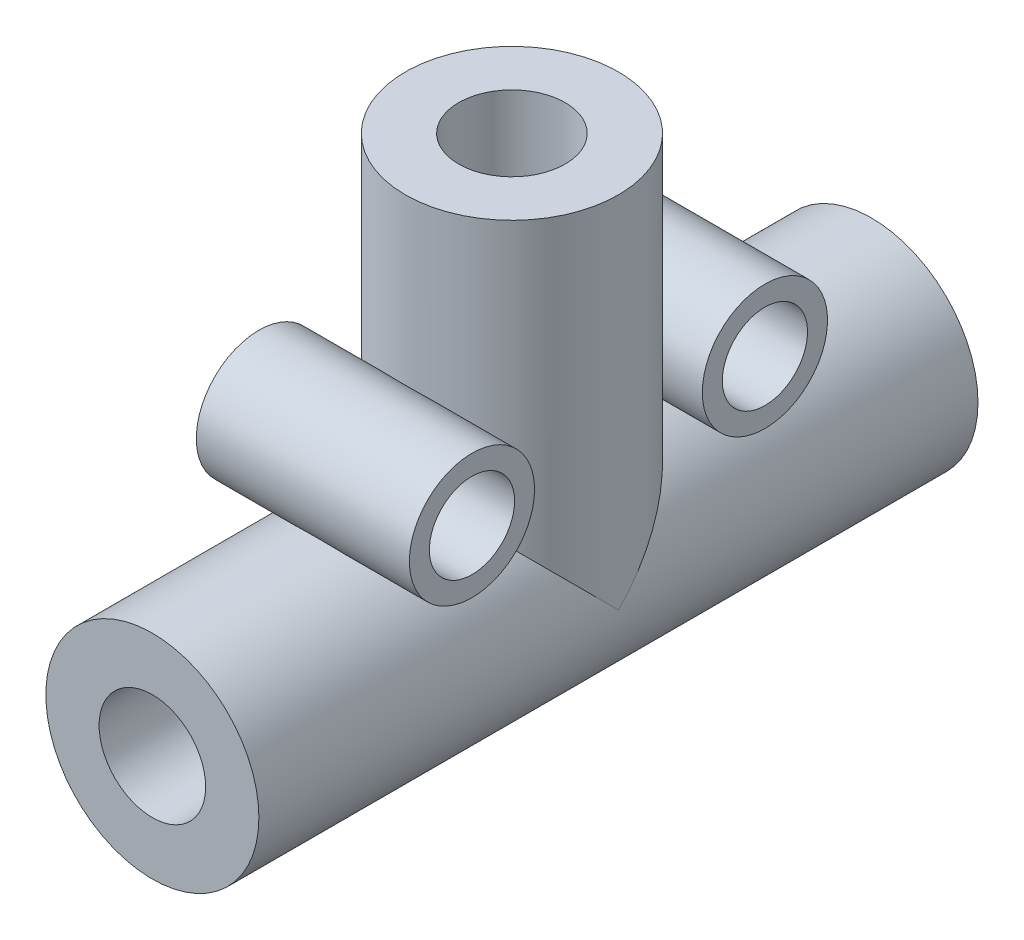
from build123d import *

# Parameters (mm, degrees)
ESQUISSE1_R             = 4
ESQUISSE1_R_2           = 2
BOSS_EXTRU_1_DEPTH      = 13.5
BOSS_EXTRU_2_REACH      = 30.137
BOSS_EXTRU_2_END_RADIUS = 4
BOSS_EXTRU_2_START      = 13.5
ESQUISSE2_R             = 4
ESQUISSE2_R_2           = 2
ESQUISSE3_R             = 2.35
ESQUISSE3_R_2           = 1.6
BOSS_EXTRU_3_DEPTH      = 4


with BuildPart() as part:
    # Esquisse1 → Boss.-Extru.1 (new, symmetric)
    with BuildSketch(Plane.XY):
        Circle(ESQUISSE1_R)
        Circle(ESQUISSE1_R_2, mode=Mode.SUBTRACT)
    extrude(amount=BOSS_EXTRU_1_DEPTH, both=True)

    # Boss.-Extru.2: up to this cylinder (the profile starts outside it)
    boss_extru_2_end = Plane(origin=(0, 0, -3.886863), z_dir=(0, 0, -1)) * Cylinder(BOSS_EXTRU_2_END_RADIUS, 69.274, mode=Mode.PRIVATE)
    # Esquisse2 → Boss.-Extru.2 (add, up to the surface)
    with BuildSketch(Plane(origin=(0, 0, 0), x_dir=(1, 0, 0), z_dir=(0, 1, 0)).offset(BOSS_EXTRU_2_START), mode=Mode.PRIVATE) as boss_extru_2_sk1:
        with Locations(Location((0, 0, 0), (0, 0, 270))):
            Circle(ESQUISSE2_R)
        with Locations(Location((0, 0, 0), (0, 0, 270))):
            Circle(ESQUISSE2_R_2, mode=Mode.SUBTRACT)
    boss_extru_2_tool1 = extrude(boss_extru_2_sk1.sketch, amount=-BOSS_EXTRU_2_REACH, mode=Mode.PRIVATE) - boss_extru_2_end
    add(boss_extru_2_tool1.solids().sort_by_distance((0, 13.5, -3.886863))[0])

    # Esquisse3 → Boss.-Extru.3 (add, symmetric)
    # profile 1 of 2: a face of its own
    with BuildSketch(Plane(origin=(0, 0, 0), x_dir=(0, 0, -1), z_dir=(1, 0, 0))):
        with Locations((-5.5, 5.5)):
            Circle(ESQUISSE3_R)
        with Locations((-5.5, 5.5)):
            Circle(ESQUISSE3_R_2, mode=Mode.SUBTRACT)
    # profile 2 of 2: a face of its own
    with BuildSketch(Plane(origin=(0, 0, 0), x_dir=(0, 0, -1), z_dir=(1, 0, 0))):
        with Locations(Location((5.5, 5.5, 0), (0, 0, 180))):
            Circle(ESQUISSE3_R)
        with Locations(Location((5.5, 5.5, 0), (0, 0, 180))):
            Circle(ESQUISSE3_R_2, mode=Mode.SUBTRACT)
    extrude(amount=BOSS_EXTRU_3_DEPTH, both=True)


solid = part.part
